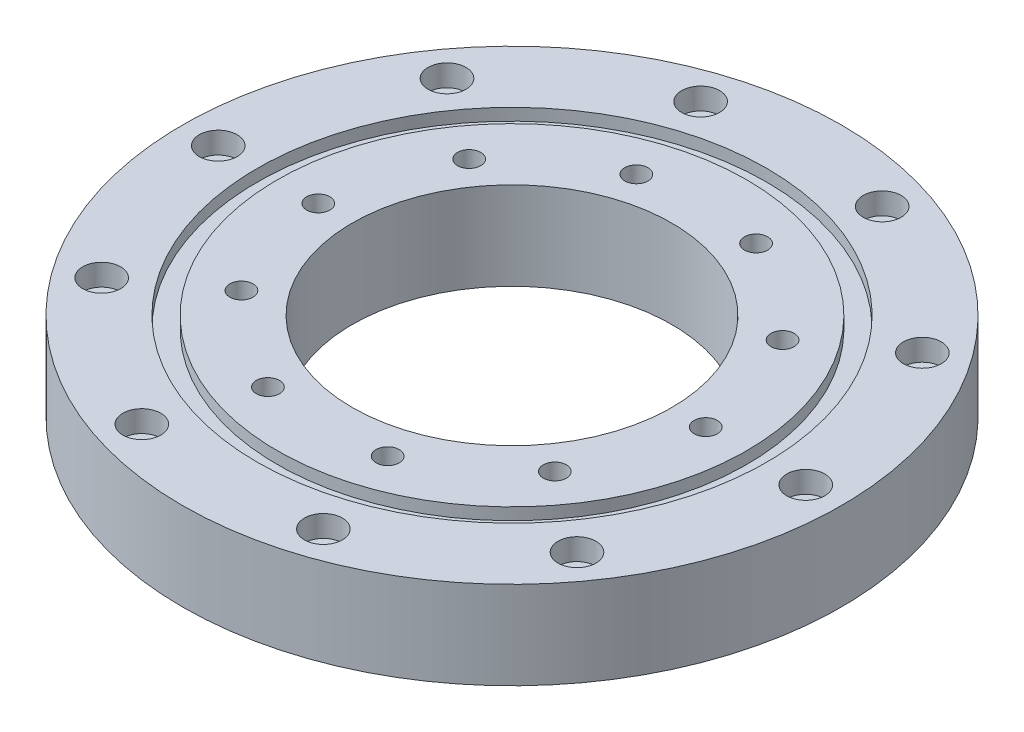
from build123d import *

# Parameters (mm, degrees)
BOSS_EXTRU_1_DEPTH           = 11
BOSS_EXTRU_1_DEPTH_BACK      = 11
ESQUISSE1_R                  = 82.5
ESQUISSE1_R_2                = 40
ESQUISSE2_R                  = 2.75
ENL_V_MAT_EXTRU_1_DEPTH      = 119.728682297
ESQUISSE4_R                  = 4.75
ENL_V_MAT_EXTRU_3_DEPTH      = 5.4
ESQUISSE5_R                  = 4.75
ENL_V_MAT_EXTRU_4_DEPTH      = 5.4
R_P_TITION_CIRCULAIRE1_COUNT = 10
ENL_V_START                  = -3
ESQUISSE3_R                  = 63.75
ESQUISSE3_R_2                = 58.75
ENL_V_MAT_EXTRU_2_DEPTH      = 122.728682297
D_GAGEMENT_M51_AT_2_COUNT    = 2
D_GAGEMENT_M51_AT_2_PITCH    = 96.989005831
D_GAGEMENT_M51_AT_3_COUNT    = 2
D_GAGEMENT_M51_AT_3_PITCH    = 92.242026005
D_GAGEMENT_M51_AT_4_COUNT    = 2
D_GAGEMENT_M51_AT_4_PITCH    = 92.242026005
D_GAGEMENT_M51_AT_5_COUNT    = 2
D_GAGEMENT_M51_AT_5_PITCH    = 57.008707262
D_GAGEMENT_M51_AT_6_COUNT    = 2
D_GAGEMENT_M51_AT_6_PITCH    = 29.971251069
D_GAGEMENT_M51_AT_7_COUNT    = 2
D_GAGEMENT_M51_AT_7_PITCH    = 57.008707262
D_GAGEMENT_M51_AT_8_COUNT    = 2
D_GAGEMENT_M51_AT_8_PITCH    = 78.465753985
D_GAGEMENT_M51_AT_9_COUNT    = 2
D_GAGEMENT_M51_AT_9_PITCH    = 29.971251069
D_GAGEMENT_M51_AT_10_COUNT   = 2
D_GAGEMENT_M51_AT_10_PITCH   = 78.465753985


with BuildPart() as part:
    # Esquisse1 → Boss.-Extru.1 (new, two sides: drawn at the far end of the back side and taken through both)
    with BuildSketch(Plane(origin=(0, 0, 0), x_dir=(1, 0, 0), z_dir=(0, 1, 0)).offset(-BOSS_EXTRU_1_DEPTH_BACK)):
        Circle(ESQUISSE1_R)
        Circle(ESQUISSE1_R_2, mode=Mode.SUBTRACT)
    extrude(amount=BOSS_EXTRU_1_DEPTH + BOSS_EXTRU_1_DEPTH_BACK)

    # Esquisse2 → Enlèv. mat.-Extru.1 (cut, symmetric)
    with BuildSketch(Plane(origin=(0, 11, 0), x_dir=(1, 0, 0), z_dir=(0, 1, 0))):
        with Locations((73.541719779, 0)):
            Circle(ESQUISSE2_R)
        with Locations((48.494502916, 0)):
            Circle(ESQUISSE2_R)
    enl_v_mat_extru_1 = extrude(amount=ENL_V_MAT_EXTRU_1_DEPTH, both=True, mode=Mode.SUBTRACT)

    # Esquisse4 → Enlèv. mat.-Extru.3 (cut)
    with BuildSketch(Plane(origin=(0, 11, 0), x_dir=(1, 0, 0), z_dir=(0, 1, 0))):
        with Locations((73.541719779, 0)):
            Circle(ESQUISSE4_R)
    enl_v_mat_extru_3 = extrude(amount=-ENL_V_MAT_EXTRU_3_DEPTH, mode=Mode.SUBTRACT)

    # Esquisse5 → Enlèv. mat.-Extru.4 (cut)
    with BuildSketch(Plane.XZ.offset(11)):
        with Locations((48.494502916, 0)):
            Circle(ESQUISSE5_R)
    enl_v_mat_extru_4 = extrude(amount=-ENL_V_MAT_EXTRU_4_DEPTH, mode=Mode.SUBTRACT)

    # Répétition circulaire1: Enlèv. mat.-Extru.1, Enlèv. mat.-Extru.3, Enlèv. mat.-Extru.4 ×10 about axis
    r_p_tition_circulaire1_axis = Axis((0, 11, 0), (0, 1, 0))
    add([enl_v_mat_extru_1.rotate(r_p_tition_circulaire1_axis, i * 360 / R_P_TITION_CIRCULAIRE1_COUNT) for i in range(1, R_P_TITION_CIRCULAIRE1_COUNT)], mode=Mode.SUBTRACT)
    add([enl_v_mat_extru_3.rotate(r_p_tition_circulaire1_axis, i * 360 / R_P_TITION_CIRCULAIRE1_COUNT) for i in range(1, R_P_TITION_CIRCULAIRE1_COUNT)], mode=Mode.SUBTRACT)
    add([enl_v_mat_extru_4.rotate(r_p_tition_circulaire1_axis, i * 360 / R_P_TITION_CIRCULAIRE1_COUNT) for i in range(1, R_P_TITION_CIRCULAIRE1_COUNT)], mode=Mode.SUBTRACT)

    # Esquisse3 → Enlèv. mat.-Extru.2 (cut)
    with BuildSketch(Plane(origin=(0, 11, 0), x_dir=(1, 0, 0), z_dir=(0, 1, 0)).offset(ENL_V_START)):
        Circle(ESQUISSE3_R)
        Circle(ESQUISSE3_R_2, mode=Mode.SUBTRACT)
    enl_v_mat_extru_2 = extrude(amount=ENL_V_MAT_EXTRU_2_DEPTH, mode=Mode.SUBTRACT)

    # Symétrie1: Enlèv. mat.-Extru.2 across plane
    add(enl_v_mat_extru_2.mirror(Plane.ZX), mode=Mode.SUBTRACT)

    # Esquisse6 → Dégagement M51 (revolve, cut)
    with BuildSketch(Plane(origin=(-48.494502916, -5.6, 0), x_dir=(0, 0, -1), z_dir=(1, 0, 0))):
        Polygon((0, 0), (0, 91.742495795), (2.9, 90), (2.9, 0), align=None)
    d_gagement_m51 = revolve(axis=Axis((-48.494502916, -11.95, 0), (0, 1, 0)), mode=Mode.SUBTRACT)

    # Dégagement M51 at 2: Dégagement M51 ×2
    with Locations(*[(i * D_GAGEMENT_M51_AT_2_PITCH, 0, 0) for i in range(1, D_GAGEMENT_M51_AT_2_COUNT)]):
        add(d_gagement_m51, mode=Mode.SUBTRACT)

    # Dégagement M51 at 3: Dégagement M51 ×2
    with Locations(*[Vector(0.9510565162951522, 0, 0.3090169943749516) * (i * D_GAGEMENT_M51_AT_3_PITCH) for i in range(1, D_GAGEMENT_M51_AT_3_COUNT)]):
        add(d_gagement_m51, mode=Mode.SUBTRACT)

    # Dégagement M51 at 4: Dégagement M51 ×2
    with Locations(*[Vector(0.9510565162951545, 0, -0.3090169943749448) * (i * D_GAGEMENT_M51_AT_4_PITCH) for i in range(1, D_GAGEMENT_M51_AT_4_COUNT)]):
        add(d_gagement_m51, mode=Mode.SUBTRACT)

    # Dégagement M51 at 5: Dégagement M51 ×2
    with Locations(*[Vector(0.5877852522924744, 0, -0.8090169943749467) * (i * D_GAGEMENT_M51_AT_5_PITCH) for i in range(1, D_GAGEMENT_M51_AT_5_COUNT)]):
        add(d_gagement_m51, mode=Mode.SUBTRACT)

    # Dégagement M51 at 6: Dégagement M51 ×2
    with Locations(*[Vector(0.3090169943749479, 0, -0.9510565162951535) * (i * D_GAGEMENT_M51_AT_6_PITCH) for i in range(1, D_GAGEMENT_M51_AT_6_COUNT)]):
        add(d_gagement_m51, mode=Mode.SUBTRACT)

    # Dégagement M51 at 7: Dégagement M51 ×2
    with Locations(*[Vector(0.5877852522924686, 0, 0.8090169943749508) * (i * D_GAGEMENT_M51_AT_7_PITCH) for i in range(1, D_GAGEMENT_M51_AT_7_COUNT)]):
        add(d_gagement_m51, mode=Mode.SUBTRACT)

    # Dégagement M51 at 8: Dégagement M51 ×2
    with Locations(*[Vector(0.8090169943749447, 0, 0.587785252292477) * (i * D_GAGEMENT_M51_AT_8_PITCH) for i in range(1, D_GAGEMENT_M51_AT_8_COUNT)]):
        add(d_gagement_m51, mode=Mode.SUBTRACT)

    # Dégagement M51 at 9: Dégagement M51 ×2
    with Locations(*[Vector(0.3090169943749415, 0, 0.9510565162951555) * (i * D_GAGEMENT_M51_AT_9_PITCH) for i in range(1, D_GAGEMENT_M51_AT_9_COUNT)]):
        add(d_gagement_m51, mode=Mode.SUBTRACT)

    # Dégagement M51 at 10: Dégagement M51 ×2
    with Locations(*[Vector(0.8090169943749487, 0, -0.5877852522924714) * (i * D_GAGEMENT_M51_AT_10_PITCH) for i in range(1, D_GAGEMENT_M51_AT_10_COUNT)]):
        add(d_gagement_m51, mode=Mode.SUBTRACT)


solid = part.part
